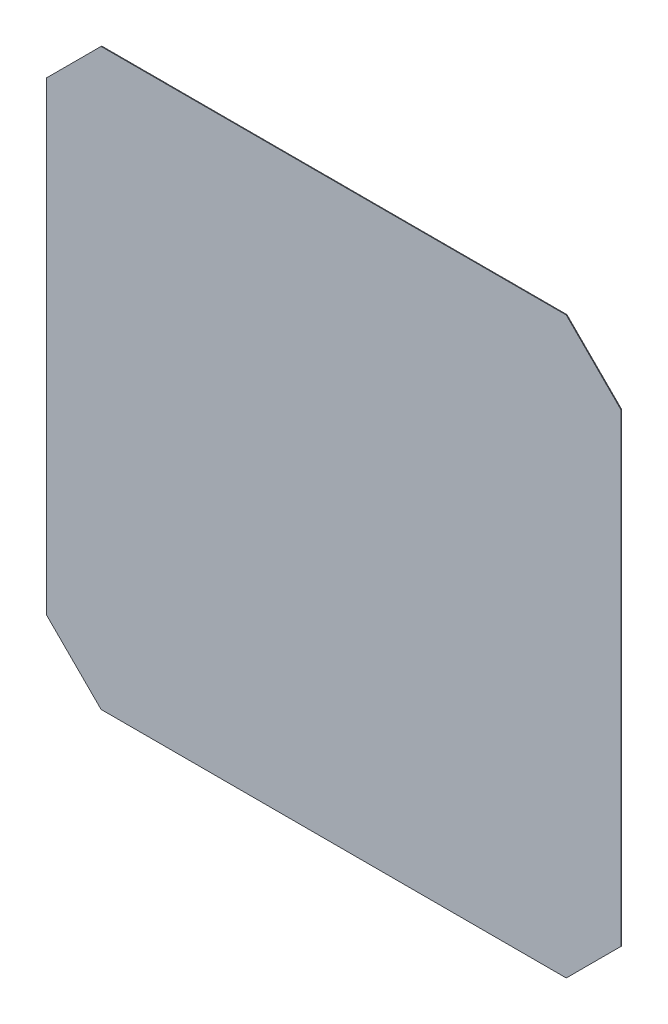
from build123d import *

# Parameters (mm, degrees)
SKETCH1_W               = 125
SKETCH1_H               = 125
BOSS_EXTRUDE1_DEPTH     = 0.15
CUT_EXTRUDE1_DEPTH      = 89.388474927
MIRROR2_COPY_1_DEPTH    = 89.388474927
SKETCH4_W               = 3
SKETCH4_H               = 5.4
BOSS_EXTRUDE2_DEPTH     = 0.01
LPATTERN1_COUNT         = 2
LPATTERN1_PITCH         = 38.5
LPATTERN1_COL_COUNT     = 2
LPATTERN1_COL_PITCH     = 38.5
MIRROR3_COPY_1_SKETCH_W = 3
MIRROR3_COPY_1_SKETCH_H = 5.4
MIRROR3_COPY_1_DEPTH    = 0.01
MIRROR3_COPY_2_SKETCH_W = 3
MIRROR3_COPY_2_SKETCH_H = 5.4
MIRROR3_COPY_2_DEPTH    = 0.01


with BuildPart() as part:
    # Sketch1 → Boss-Extrude1 (new body)
    with BuildSketch(Plane.XY):
        Rectangle(SKETCH1_W, SKETCH1_H)
    extrude(amount=BOSS_EXTRUDE1_DEPTH)

    # Sketch2 → Cut-Extrude1 (cut, through all)
    with BuildSketch(Plane.XY.offset(0.15)):
        Polygon((-62.5, 50.63708499), (-50.63708499, 62.5), (-62.5, 62.5), align=None)
    cut_extrude1 = extrude(amount=-CUT_EXTRUDE1_DEPTH, mode=Mode.SUBTRACT)

    # Mirror1: Cut-Extrude1 across plane
    add(cut_extrude1.mirror(Plane.ZX), mode=Mode.SUBTRACT)

    # Mirror2: Cut-Extrude1 across plane
    add(cut_extrude1.mirror(Plane(origin=(0, 0, 0), x_dir=(0, 0, 1), z_dir=(1, 0, 0))), mode=Mode.SUBTRACT)

    # Mirror2 copy 1 sketch → Mirror2 copy 1 (cut, through all)
    with BuildSketch(Plane(origin=(0, 0, 0.15), x_dir=(-1, 0, 0), z_dir=(0, 0, 1))):
        Polygon((-62.5, 50.63708499), (-50.63708499, 62.5), (-62.5, 62.5), align=None)
    extrude(amount=-MIRROR2_COPY_1_DEPTH, mode=Mode.SUBTRACT)

    # Sketch4 → Boss-Extrude2 (add)
    with BuildSketch(Plane(origin=(0, 0, 0), x_dir=(-1, 0, 0), z_dir=(0, 0, -1))):
        with Locations((0, 59.8)):
            Rectangle(SKETCH4_W, SKETCH4_H)
    boss_extrude2 = extrude(amount=BOSS_EXTRUDE2_DEPTH)

    # LPattern1: Boss-Extrude2 ×2
    with Locations(*[(-i * LPATTERN1_PITCH, 0, 0) for i in range(1, LPATTERN1_COUNT)]):
        add(boss_extrude2)

    # LPattern1 col: Boss-Extrude2 ×2
    with Locations(*[(i * LPATTERN1_COL_PITCH, 0, 0) for i in range(1, LPATTERN1_COL_COUNT)]):
        add(boss_extrude2)

    # Mirror3: Boss-Extrude2 across plane
    add(boss_extrude2.mirror(Plane.ZX))

    # Mirror3 copy 1 sketch → Mirror3 copy 1 (add)
    with BuildSketch(Plane(origin=(-38.5, 0, 0), x_dir=(-1, 0, 0), z_dir=(0, 0, -1))):
        with Locations((0, -59.8)):
            Rectangle(MIRROR3_COPY_1_SKETCH_W, MIRROR3_COPY_1_SKETCH_H)
    extrude(amount=MIRROR3_COPY_1_DEPTH)

    # Mirror3 copy 2 sketch → Mirror3 copy 2 (add)
    with BuildSketch(Plane(origin=(38.5, 0, 0), x_dir=(-1, 0, 0), z_dir=(0, 0, -1))):
        with Locations((0, -59.8)):
            Rectangle(MIRROR3_COPY_2_SKETCH_W, MIRROR3_COPY_2_SKETCH_H)
    extrude(amount=MIRROR3_COPY_2_DEPTH)


solid = part.part
